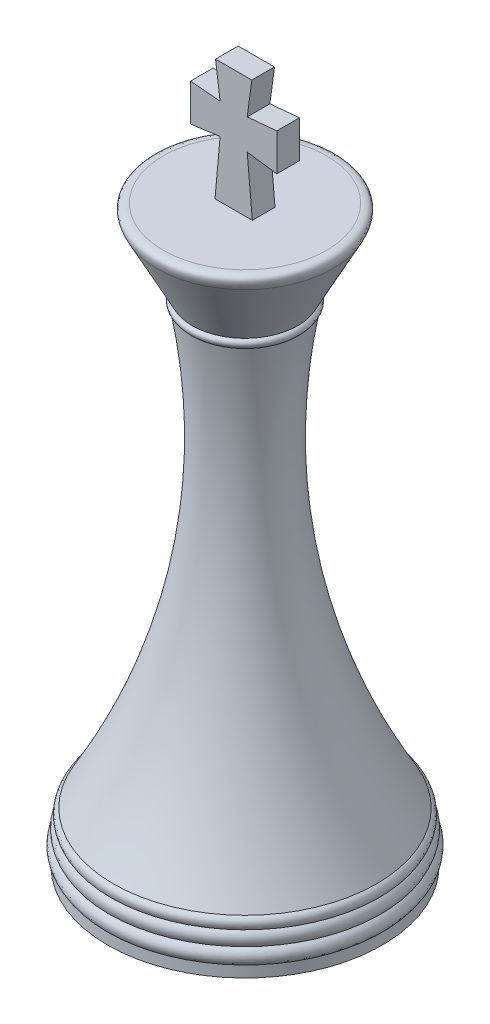
from build123d import *

# Parameters (mm, degrees)
BOSS_EXTRUDE1_DEPTH      = 1.5
BOSS_EXTRUDE1_DEPTH_BACK = 1.5


with BuildPart() as part:
    # Body → Revolve2 (revolve)
    with BuildSketch(Plane.XY):
        with BuildLine():
            Line((0, -35.112605452), (-18.174629027, -35.112605452))
            Line((-18.174629027, -35.112605452), (-18.174629027, -33.622393907))
            add(Edge.make_bspline(
                [(-18.174629027, -33.622393907), (-18.746777836, -32.93871692), (-18.649381124, -32.21761099), (-17.978486488, -31.656539775)],
                knots=[0, 0, 0, 0, 1, 1, 1, 1], degree=3))
            add(Edge.make_bspline(
                [(-17.978486488, -31.656539775), (-18.565257788, -30.617916679), (-17.752329486, -29.882490381)],
                knots=[0, 0, 0, 1, 1, 1], degree=2))
            add(Edge.make_bspline(
                [(-17.752329486, -29.882490381), (-18.238397249, -28.955270963), (-17.440670859, -28.44106923)],
                knots=[0, 0, 0, 1, 1, 1], degree=2))
            add(Edge.make_bspline(
                [(-17.440670859, -28.44106923), (-1.650744274, -0.748893793), (-7.023375291, 29.189979279)],
                knots=[0, 0, 0, 1, 1, 1], degree=2))
            add(Edge.make_bspline(
                [(-7.023375291, 29.189979279), (-7.559938915, 29.704191997), (-7.422823029, 30.133693737), (-6.991039479, 30.344569347)],
                knots=[0, 0, 0, 0, 1, 1, 1, 1], degree=3))
            Line((-6.991039479, 30.344569347), (-11.621054148, 39.190746791))
            add(Edge.make_bspline(
                [(-11.621054148, 39.190746791), (-12.576182421, 40.990355328), (-10.835631062, 40.921958778)],
                knots=[0, 0, 0, 1, 1, 1], degree=2))
            Line((-10.835631062, 40.921958778), (0, 40.921958778))
            Line((0, 40.921958778), (0, -35.112605452))
        make_face()
    revolve(axis=Axis((0, 55.231222452, 0), (0, -1, 0)))

    # Head → Boss-Extrude1 (add, two sides: drawn at the far end of the back side and taken through both)
    with BuildSketch(Plane.XY.offset(-BOSS_EXTRUDE1_DEPTH_BACK)):
        Polygon((2.472072564, 40.921958778), (-2.472072564, 40.921958778), (-1.793454985, 48.407527059), (-5.713262358, 47.878921151), (-5.713262358, 52.804097239), (-1.793454985, 52.448740091), (-2.404603177, 56.980628878), (2.404603177, 56.980628878), (1.793454985, 52.448740091), (5.713262358, 52.804097239), (5.713262358, 47.878921151), (1.793454985, 48.407527059), align=None)
    extrude(amount=BOSS_EXTRUDE1_DEPTH + BOSS_EXTRUDE1_DEPTH_BACK)


solid = part.part
